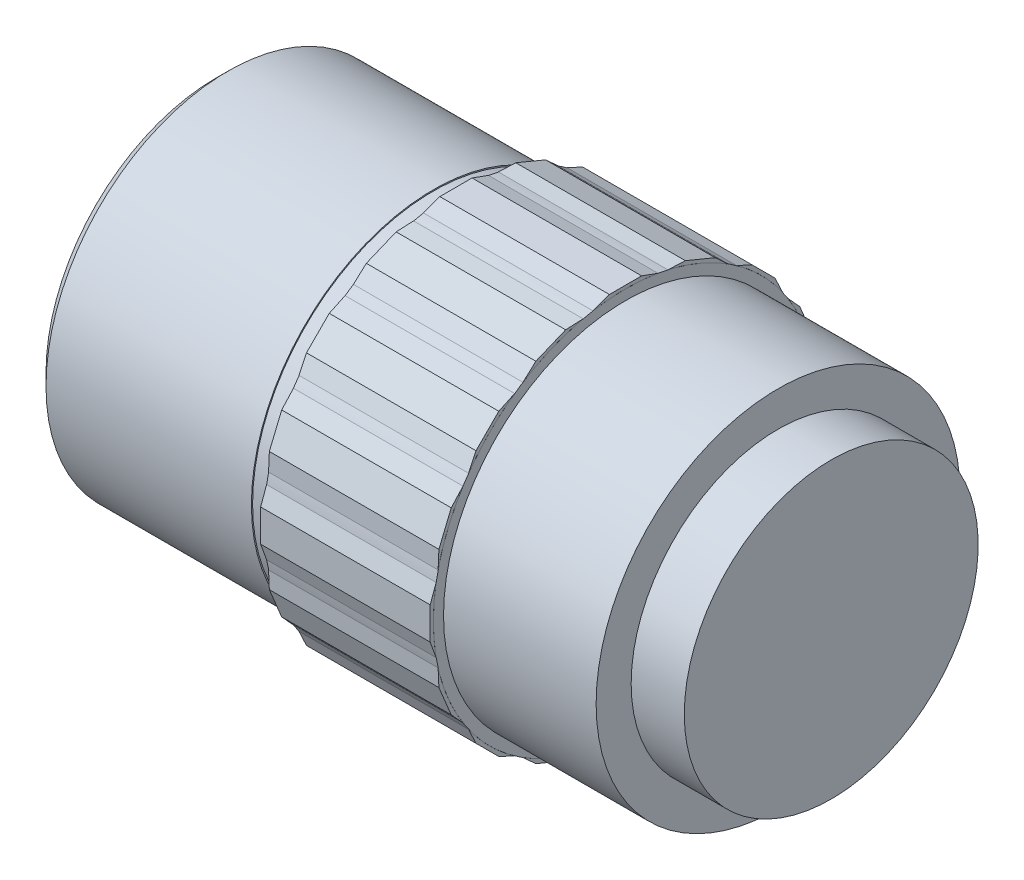
from build123d import *

# Parameters (mm, degrees)
BOSS_EXTRUDE1_DEPTH    = 15
BOSS_EXTRUDE1_2_DEPTH  = 15
BOSS_EXTRUDE1_3_DEPTH  = 15
BOSS_EXTRUDE1_4_DEPTH  = 15
BOSS_EXTRUDE1_5_DEPTH  = 15
BOSS_EXTRUDE1_6_DEPTH  = 15
BOSS_EXTRUDE1_7_DEPTH  = 15
BOSS_EXTRUDE1_8_DEPTH  = 15
BOSS_EXTRUDE1_9_DEPTH  = 15
BOSS_EXTRUDE1_10_DEPTH = 15
BOSS_EXTRUDE1_11_DEPTH = 15
BOSS_EXTRUDE1_12_DEPTH = 15
BOSS_EXTRUDE1_13_DEPTH = 15
BOSS_EXTRUDE1_14_DEPTH = 15
BOSS_EXTRUDE1_15_DEPTH = 15
BOSS_EXTRUDE1_16_DEPTH = 15
CUT_EXTRUDE1_START     = 2
SKETCH3_R              = 16.1
SKETCH3_R_2            = 15.993618491
CUT_EXTRUDE1_DEPTH     = 2


with BuildPart() as part:
    # Sketch1 → Revolve1 (revolve)
    with BuildSketch(Plane.XY, mode=Mode.PRIVATE) as revolve1_sk:
        Polygon((0, 0), (0, 13), (-4.7, 13), (-4.7, 16.1), (-18.2, 16.1), (-18.2, 17), (-33.2, 17), (-33.2, 16.1), (-53.370470841, 16.1), (-54.399998096, 15.070472746), (-54.399998096, 7.872343539), (-54.7, 7.572341635), (-54.7, 0), align=None)
    revolve(revolve1_sk.sketch.rotate(Axis((-54.7, 0, 0), (1, 0, 0)), 90), axis=Axis((-54.7, 0, 0), (1, 0, 0)))

    # Sketch3 → Cut-Extrude1 (cut)
    with BuildSketch(Plane.ZY.offset(33.2).offset(CUT_EXTRUDE1_START)):
        Circle(SKETCH3_R)
        Circle(SKETCH3_R_2, mode=Mode.SUBTRACT)
    extrude(amount=-CUT_EXTRUDE1_DEPTH, mode=Mode.SUBTRACT)


with BuildPart() as body_2:
    # Sketch2 → Boss-Extrude1 (new body)
    with BuildSketch(Plane.ZY.offset(33.2)):
        with BuildLine():
            Line((17.280365855, 1.425744986), (16.754324522, 2.879689187))
            ThreePointArc((16.754324522, 2.879689187), (16.938469778, 1.445074933), (17, 0))
            ThreePointArc((17, 0), (16.938469778, -1.445074933), (16.754324522, -2.879689187))
            Line((16.754324522, -2.879689187), (17.280365855, -1.425744986))
            Line((17.280365855, -1.425744986), (17.280365855, 1.425744986))
        make_face()
    extrude(amount=-BOSS_EXTRUDE1_DEPTH)


with BuildPart() as body_3:
    # Sketch2 → Boss-Extrude1 2 (new body)
    with BuildSketch(Plane.ZY.offset(33.2)):
        with BuildLine():
            Line((16.510585312, -5.295693106), (16.580986849, -3.751116515))
            ThreePointArc((16.580986849, -3.751116515), (15.705952053, -6.50561835), (14.376968165, -9.072088315))
            Line((14.376968165, -9.072088315), (15.419367342, -7.930126329))
            Line((15.419367342, -7.930126329), (16.510585312, -5.295693106))
        make_face()
    extrude(amount=-BOSS_EXTRUDE1_2_DEPTH)


with BuildPart() as body_4:
    # Sketch2 → Boss-Extrude1 3 (new body)
    with BuildSketch(Plane.ZY.offset(33.2)):
        with BuildLine():
            Line((13.227217825, -11.210909929), (13.883344235, -9.810848732))
            ThreePointArc((13.883344235, -9.810848732), (12.02081528, -12.02081528), (9.810848732, -13.883344235))
            Line((9.810848732, -13.883344235), (11.210909929, -13.227217825))
            Line((11.210909929, -13.227217825), (13.227217825, -11.210909929))
        make_face()
    extrude(amount=-BOSS_EXTRUDE1_3_DEPTH)


with BuildPart() as body_5:
    # Sketch2 → Boss-Extrude1 4 (new body)
    with BuildSketch(Plane.ZY.offset(33.2)):
        with BuildLine():
            Line((7.930126329, -15.419367342), (9.072088315, -14.376968165))
            ThreePointArc((9.072088315, -14.376968165), (6.50561835, -15.705952053), (3.751116515, -16.580986849))
            Line((3.751116515, -16.580986849), (5.295693106, -16.510585312))
            Line((5.295693106, -16.510585312), (7.930126329, -15.419367342))
        make_face()
    extrude(amount=-BOSS_EXTRUDE1_4_DEPTH)


with BuildPart() as body_6:
    # Sketch2 → Boss-Extrude1 5 (new body)
    with BuildSketch(Plane.ZY.offset(33.2)):
        with BuildLine():
            Line((1.425744986, -17.280365855), (2.879689187, -16.754324522))
            ThreePointArc((2.879689187, -16.754324522), (0, -17), (-2.879689187, -16.754324522))
            Line((-2.879689187, -16.754324522), (-1.425744986, -17.280365855))
            Line((-1.425744986, -17.280365855), (1.425744986, -17.280365855))
        make_face()
    extrude(amount=-BOSS_EXTRUDE1_5_DEPTH)


with BuildPart() as body_7:
    # Sketch2 → Boss-Extrude1 6 (new body)
    with BuildSketch(Plane.ZY.offset(33.2)):
        with BuildLine():
            Line((-5.295693106, -16.510585312), (-3.751116515, -16.580986849))
            ThreePointArc((-3.751116515, -16.580986849), (-6.50561835, -15.705952053), (-9.072088315, -14.376968165))
            Line((-9.072088315, -14.376968165), (-7.930126329, -15.419367342))
            Line((-7.930126329, -15.419367342), (-5.295693106, -16.510585312))
        make_face()
    extrude(amount=-BOSS_EXTRUDE1_6_DEPTH)


with BuildPart() as body_8:
    # Sketch2 → Boss-Extrude1 7 (new body)
    with BuildSketch(Plane.ZY.offset(33.2)):
        with BuildLine():
            Line((-11.210909929, -13.227217825), (-9.810848732, -13.883344235))
            ThreePointArc((-9.810848732, -13.883344235), (-12.02081528, -12.02081528), (-13.883344235, -9.810848732))
            Line((-13.883344235, -9.810848732), (-13.227217825, -11.210909929))
            Line((-13.227217825, -11.210909929), (-11.210909929, -13.227217825))
        make_face()
    extrude(amount=-BOSS_EXTRUDE1_7_DEPTH)


with BuildPart() as body_9:
    # Sketch2 → Boss-Extrude1 8 (new body)
    with BuildSketch(Plane.ZY.offset(33.2)):
        with BuildLine():
            Line((-15.419367342, -7.930126329), (-14.376968165, -9.072088315))
            ThreePointArc((-14.376968165, -9.072088315), (-15.705952053, -6.50561835), (-16.580986849, -3.751116515))
            Line((-16.580986849, -3.751116515), (-16.510585312, -5.295693106))
            Line((-16.510585312, -5.295693106), (-15.419367342, -7.930126329))
        make_face()
    extrude(amount=-BOSS_EXTRUDE1_8_DEPTH)


with BuildPart() as body_10:
    # Sketch2 → Boss-Extrude1 9 (new body)
    with BuildSketch(Plane.ZY.offset(33.2)):
        with BuildLine():
            ThreePointArc((-16.754324522, -2.879689187), (-17, 0), (-16.754324522, 2.879689187))
            Line((-16.754324522, 2.879689187), (-17.280365855, 1.425744986))
            Line((-17.280365855, 1.425744986), (-17.280365855, -1.425744986))
            Line((-17.280365855, -1.425744986), (-16.754324522, -2.879689187))
        make_face()
    extrude(amount=-BOSS_EXTRUDE1_9_DEPTH)


with BuildPart() as body_11:
    # Sketch2 → Boss-Extrude1 10 (new body)
    with BuildSketch(Plane.ZY.offset(33.2)):
        with BuildLine():
            ThreePointArc((-16.580986849, 3.751116515), (-15.705952053, 6.50561835), (-14.376968165, 9.072088315))
            Line((-14.376968165, 9.072088315), (-15.419367342, 7.930126329))
            Line((-15.419367342, 7.930126329), (-16.510585312, 5.295693106))
            Line((-16.510585312, 5.295693106), (-16.580986849, 3.751116515))
        make_face()
    extrude(amount=-BOSS_EXTRUDE1_10_DEPTH)


with BuildPart() as body_12:
    # Sketch2 → Boss-Extrude1 11 (new body)
    with BuildSketch(Plane.ZY.offset(33.2)):
        with BuildLine():
            ThreePointArc((-13.883344235, 9.810848732), (-12.02081528, 12.02081528), (-9.810848732, 13.883344235))
            Line((-9.810848732, 13.883344235), (-11.210909929, 13.227217825))
            Line((-11.210909929, 13.227217825), (-13.227217825, 11.210909929))
            Line((-13.227217825, 11.210909929), (-13.883344235, 9.810848732))
        make_face()
    extrude(amount=-BOSS_EXTRUDE1_11_DEPTH)


with BuildPart() as body_13:
    # Sketch2 → Boss-Extrude1 12 (new body)
    with BuildSketch(Plane.ZY.offset(33.2)):
        with BuildLine():
            ThreePointArc((-9.072088315, 14.376968165), (-6.50561835, 15.705952053), (-3.751116515, 16.580986849))
            Line((-3.751116515, 16.580986849), (-5.295693106, 16.510585312))
            Line((-5.295693106, 16.510585312), (-7.930126329, 15.419367342))
            Line((-7.930126329, 15.419367342), (-9.072088315, 14.376968165))
        make_face()
    extrude(amount=-BOSS_EXTRUDE1_12_DEPTH)


with BuildPart() as body_14:
    # Sketch2 → Boss-Extrude1 13 (new body)
    with BuildSketch(Plane.ZY.offset(33.2)):
        with BuildLine():
            ThreePointArc((-2.879689187, 16.754324522), (0, 17), (2.879689187, 16.754324522))
            Line((2.879689187, 16.754324522), (1.425744986, 17.280365855))
            Line((1.425744986, 17.280365855), (-1.425744986, 17.280365855))
            Line((-1.425744986, 17.280365855), (-2.879689187, 16.754324522))
        make_face()
    extrude(amount=-BOSS_EXTRUDE1_13_DEPTH)


with BuildPart() as body_15:
    # Sketch2 → Boss-Extrude1 14 (new body)
    with BuildSketch(Plane.ZY.offset(33.2)):
        with BuildLine():
            ThreePointArc((3.751116515, 16.580986849), (6.50561835, 15.705952053), (9.072088315, 14.376968165))
            Line((9.072088315, 14.376968165), (7.930126329, 15.419367342))
            Line((7.930126329, 15.419367342), (5.295693106, 16.510585312))
            Line((5.295693106, 16.510585312), (3.751116515, 16.580986849))
        make_face()
    extrude(amount=-BOSS_EXTRUDE1_14_DEPTH)


with BuildPart() as body_16:
    # Sketch2 → Boss-Extrude1 15 (new body)
    with BuildSketch(Plane.ZY.offset(33.2)):
        with BuildLine():
            ThreePointArc((9.810848732, 13.883344235), (12.02081528, 12.02081528), (13.883344235, 9.810848732))
            Line((13.883344235, 9.810848732), (13.227217825, 11.210909929))
            Line((13.227217825, 11.210909929), (11.210909929, 13.227217825))
            Line((11.210909929, 13.227217825), (9.810848732, 13.883344235))
        make_face()
    extrude(amount=-BOSS_EXTRUDE1_15_DEPTH)


with BuildPart() as body_17:
    # Sketch2 → Boss-Extrude1 16 (new body)
    with BuildSketch(Plane.ZY.offset(33.2)):
        with BuildLine():
            ThreePointArc((14.376968165, 9.072088315), (15.705952053, 6.50561835), (16.580986849, 3.751116515))
            Line((16.580986849, 3.751116515), (16.510585312, 5.295693106))
            Line((16.510585312, 5.295693106), (15.419367342, 7.930126329))
            Line((15.419367342, 7.930126329), (14.376968165, 9.072088315))
        make_face()
    extrude(amount=-BOSS_EXTRUDE1_16_DEPTH)


solid = Compound([part.part, body_2.part, body_3.part, body_4.part, body_5.part, body_6.part, body_7.part, body_8.part, body_9.part, body_10.part, body_11.part, body_12.part, body_13.part, body_14.part, body_15.part, body_16.part, body_17.part])
